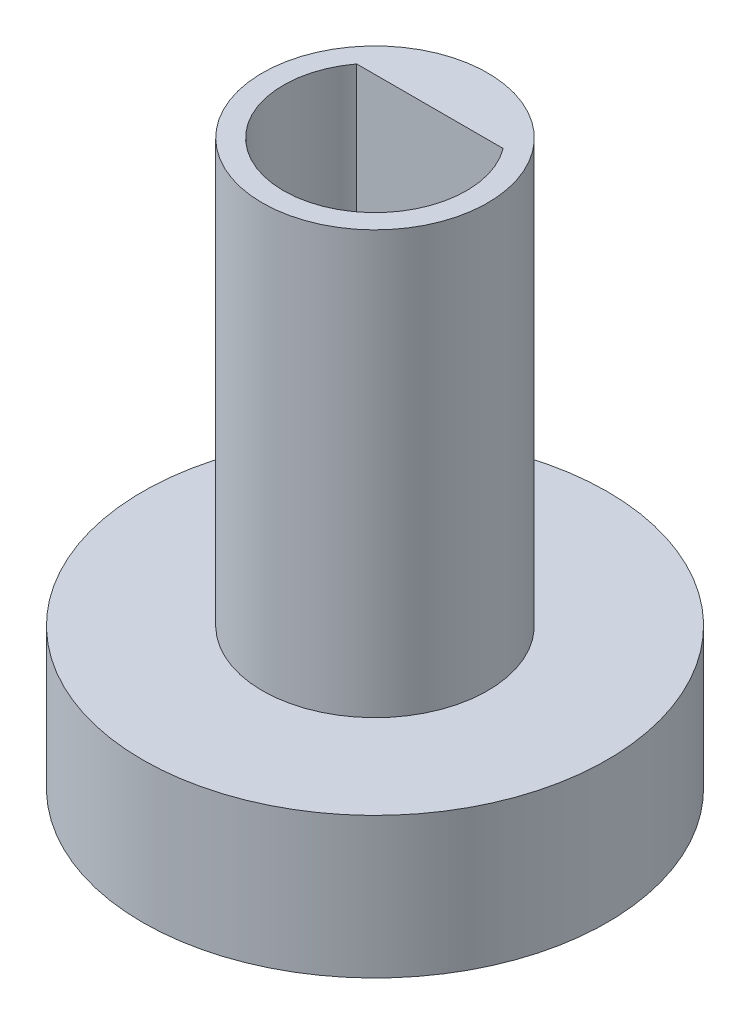
from build123d import *
from build123d.topology import SkipClean

# Parameters (mm, degrees)
CROQUIS1_R              = 8.25
SALIENTE_EXTRUIR1_DEPTH = 5
CROQUIS2_R              = 4
SALIENTE_EXTRUIR2_DEPTH = 15


with BuildPart() as part:
    # Croquis1 → Saliente-Extruir1 (new body)
    with BuildSketch(Plane(origin=(0, 0, 0), x_dir=(1, 0, 0), z_dir=(0, 1, 0))):
        with Locations(Location((0, 0, 0), (0, 0, 270))):
            Circle(CROQUIS1_R)
        with BuildLine():
            Line((-2.6, 1.95), (2.6, 1.95))
            ThreePointArc((2.6, 1.95), (0, -3.25), (-2.6, 1.95))
        make_face(mode=Mode.SUBTRACT)
    extrude(amount=SALIENTE_EXTRUIR1_DEPTH)

    # Croquis2 → Saliente-Extruir2 (add)
    with SkipClean():  # the faces are left unmerged after this step: merging them gives an invalid solid
        with BuildSketch(Plane(origin=(0, 5, 0), x_dir=(1, 0, 0), z_dir=(0, 1, 0))):
            with Locations(Location((0, 0, 0), (0, 0, 270))):
                Circle(CROQUIS2_R)
            with BuildLine():
                Line((2.6, 1.95), (-2.6, 1.95))
                ThreePointArc((-2.6, 1.95), (0, -3.25), (2.6, 1.95))
            make_face(mode=Mode.SUBTRACT)
        extrude(amount=SALIENTE_EXTRUIR2_DEPTH)


solid = part.part
